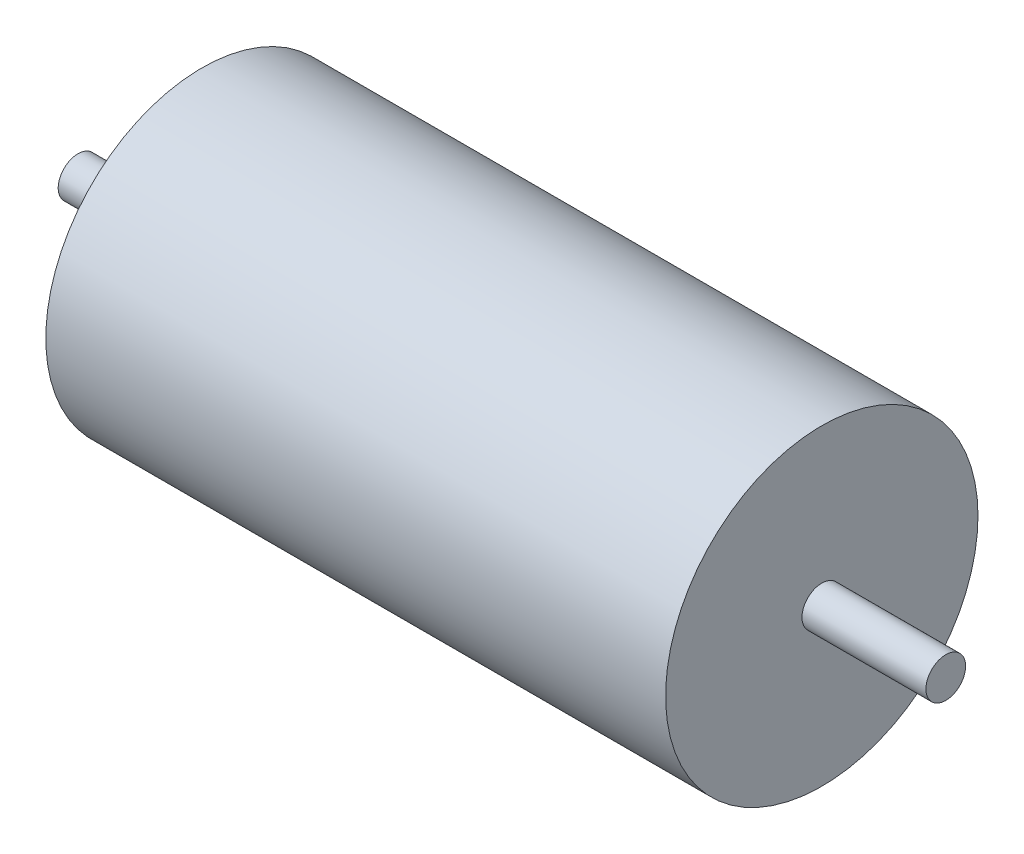
from build123d import *

# Parameters (mm, degrees)
SKETCH1_R                = 31.5
SKETCH1_R_2              = 4
BOSS_EXTRUDE1_DEPTH      = 125
BOSS_EXTRUDE2_DEPTH      = 150
BOSS_EXTRUDE2_DEPTH_BACK = 25
SKETCH1_2_R              = 4


with BuildPart() as part:
    # Sketch1 → Boss-Extrude1 (new body)
    with BuildSketch(Plane(origin=(0, 0, 0), x_dir=(0, 0, -1), z_dir=(1, 0, 0))):
        Circle(SKETCH1_R)
        Circle(SKETCH1_R_2, mode=Mode.SUBTRACT)
    extrude(amount=BOSS_EXTRUDE1_DEPTH)

    # Sketch1<2> → Boss-Extrude2 (add, two sides: drawn at the far end of the back side and taken through both)
    with BuildSketch(Plane(origin=(0, 0, 0), x_dir=(0, 0, -1), z_dir=(1, 0, 0)).offset(-BOSS_EXTRUDE2_DEPTH_BACK)):
        Circle(SKETCH1_2_R)
    extrude(amount=BOSS_EXTRUDE2_DEPTH + BOSS_EXTRUDE2_DEPTH_BACK)


solid = part.part
